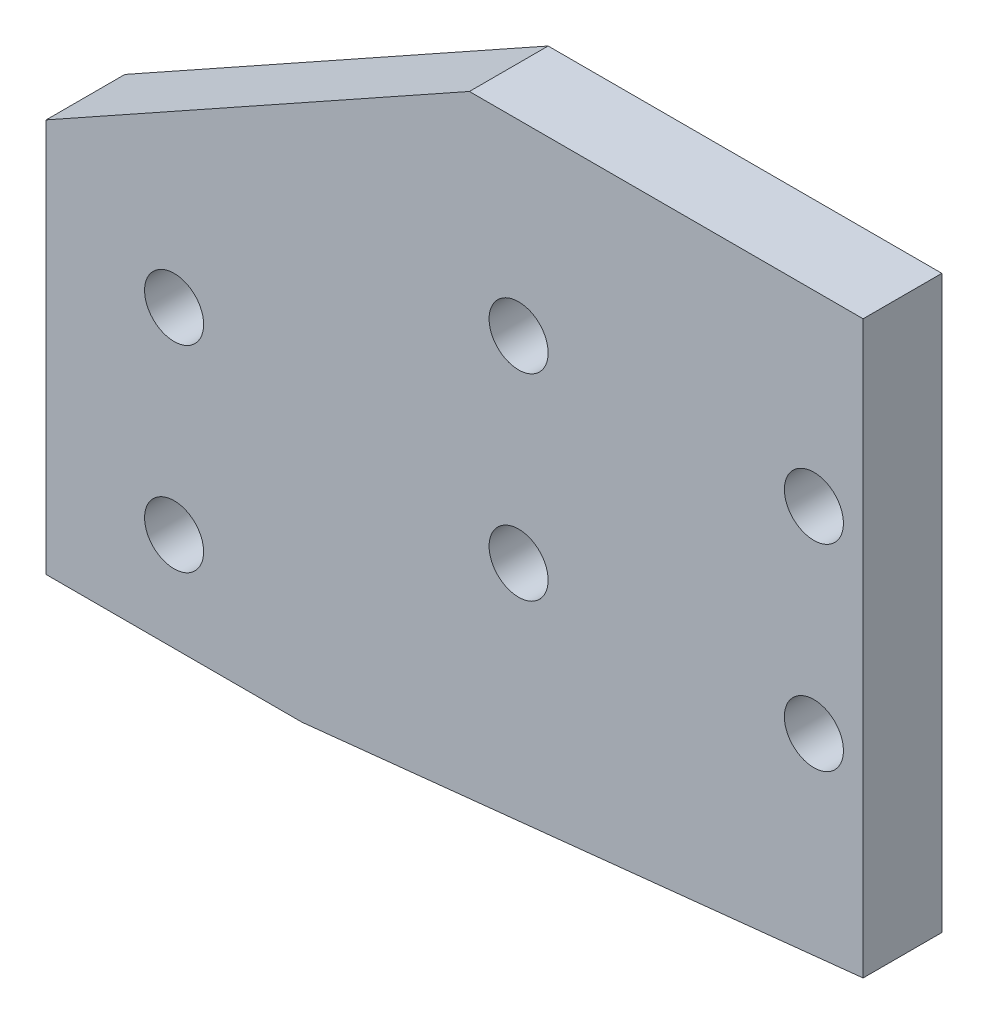
from build123d import *

# Parameters (mm, degrees)
SKETCH_1_R      = 1.5
EXTRUDE_1_DEPTH = 4


with BuildPart() as part:
    # 草图1 → 凸台-拉伸1 (new body)
    with BuildSketch(Plane.XY):
        Polygon((0, 0), (13, 0), (41.5, 3), (41.5, 32), (21.5, 32), (0, 20), align=None)
        with Locations((6.5, 15)):
            Circle(SKETCH_1_R, mode=Mode.SUBTRACT)
        with Locations(Location((6.5, 5, 0), (0, 0, 180))):
            Circle(SKETCH_1_R, mode=Mode.SUBTRACT)
        with Locations((24, 12.5)):
            Circle(SKETCH_1_R, mode=Mode.SUBTRACT)
        with Locations(Location((39, 12.5, 0), (0, 0, 180))):
            Circle(SKETCH_1_R, mode=Mode.SUBTRACT)
        with Locations(Location((24, 22.5, 0), (0, 0, 180))):
            Circle(SKETCH_1_R, mode=Mode.SUBTRACT)
        with Locations((39, 22.5)):
            Circle(SKETCH_1_R, mode=Mode.SUBTRACT)
    extrude(amount=EXTRUDE_1_DEPTH)


solid = part.part
